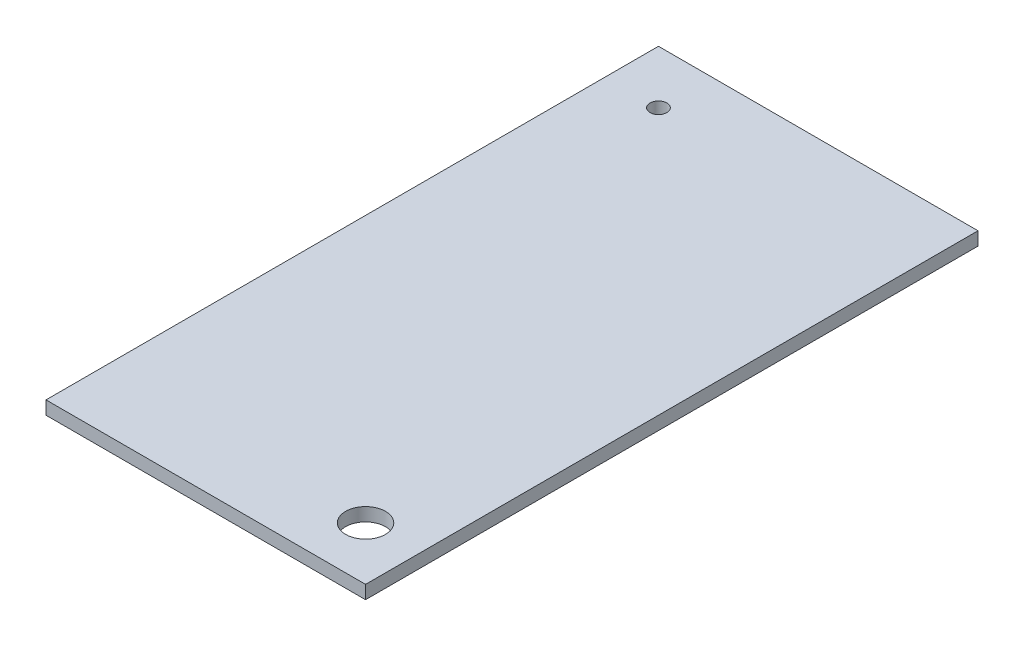
from build123d import *

# Parameters (mm, degrees)
SKETCH1_W           = 76.2
SKETCH1_H           = 146.05
SKETCH1_R           = 4.7625
SKETCH1_R_2         = 2
BOSS_EXTRUDE1_DEPTH = 3.175


with BuildPart() as part:
    # Sketch1 → Boss-Extrude1 (new body)
    with BuildSketch(Plane(origin=(0, 0, 0), x_dir=(1, 0, 0), z_dir=(0, 1, 0))):
        with Locations((38.1, 73.025)):
            Rectangle(SKETCH1_W, SKETCH1_H)
        with Locations(Location((63.5, 12.7, 0), (0, 0, 270))):
            Circle(SKETCH1_R, mode=Mode.SUBTRACT)
        with Locations(Location((12.7, 133.35, 0), (0, 0, 270))):
            Circle(SKETCH1_R_2, mode=Mode.SUBTRACT)
    extrude(amount=BOSS_EXTRUDE1_DEPTH)


solid = part.part
